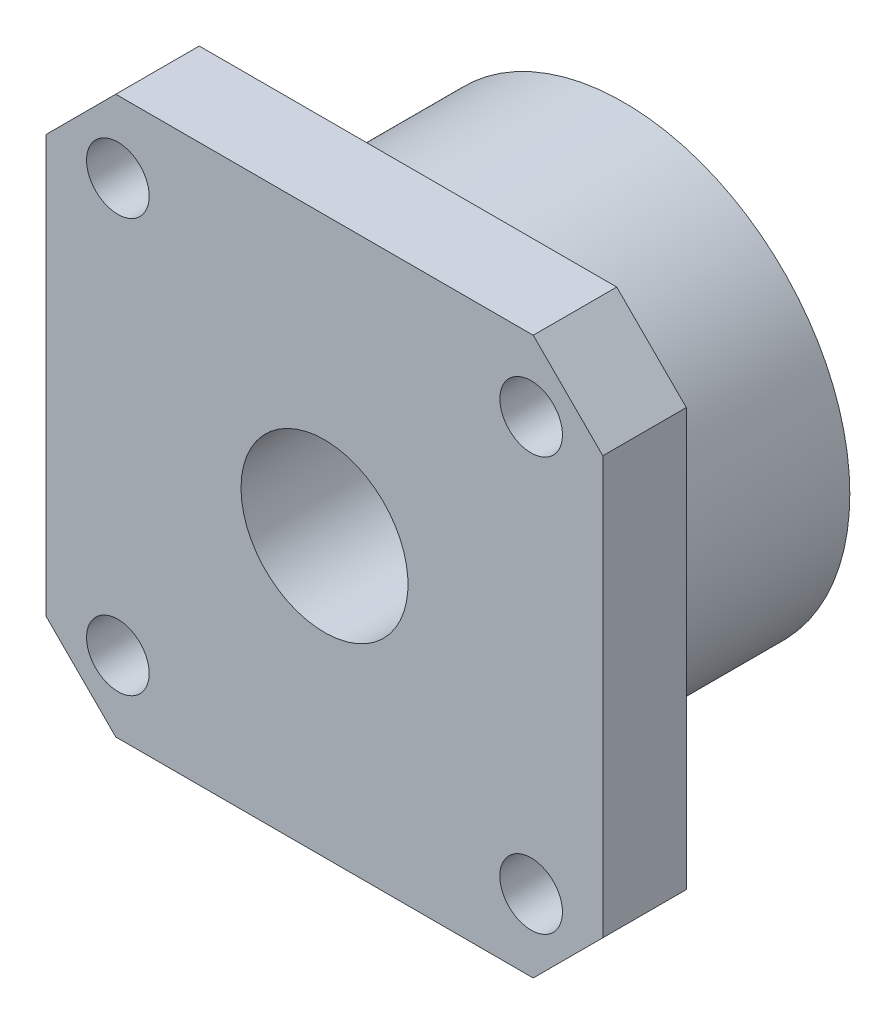
from build123d import *

# Parameters (mm, degrees)
SKETCH_1_W          = 40
SKETCH_1_H          = 40
SKETCH_1_R          = 2.25
EXTRUDE_1_DEPTH     = 6
CHAMFER_1_SIZE      = 5
SKETCH_2_R          = 16.25
SKETCH_2_R_2        = 6
EXTRUDE_2_DEPTH     = 15.5
SKETCH_3_R          = 6
CUT_EXTRUDE_1_DEPTH = 33.252906846


with BuildPart() as part:
    # 草图1 → 凸台-拉伸1 (new body)
    with BuildSketch(Plane.XY):
        Rectangle(SKETCH_1_W, SKETCH_1_H)
        with Locations((-14.849242405, 14.849242405)):
            Circle(SKETCH_1_R, mode=Mode.SUBTRACT)
        with Locations((14.849242405, 14.849242405)):
            Circle(SKETCH_1_R, mode=Mode.SUBTRACT)
        with Locations((14.849242405, -14.849242405)):
            Circle(SKETCH_1_R, mode=Mode.SUBTRACT)
        with Locations((-14.849242405, -14.849242405)):
            Circle(SKETCH_1_R, mode=Mode.SUBTRACT)
    extrude(amount=EXTRUDE_1_DEPTH)

    # 倒角1
    chamfer_1_edges = [part.edges().sort_by_distance(p)[0] for p in [
        (-20, 20, 3),
        (20, 20, 3),
        (20, -20, 3),
        (-20, -20, 3),
    ]]
    chamfer(chamfer_1_edges, length=CHAMFER_1_SIZE)

    # 草图2 → 凸台-拉伸2 (add)
    with BuildSketch(Plane(origin=(0, 0, 0), x_dir=(-1, 0, 0), z_dir=(0, 0, -1))):
        with Locations(Location((0, 0, 0), (0, 0, 180))):
            Circle(SKETCH_2_R)
        Circle(SKETCH_2_R_2, mode=Mode.SUBTRACT)
    extrude(amount=EXTRUDE_2_DEPTH)

    # 草图3 → 切除-拉伸1 (cut, through all)
    with BuildSketch(Plane(origin=(0, 0, 0), x_dir=(-1, 0, 0), z_dir=(0, 0, -1))):
        Circle(SKETCH_3_R)
    extrude(amount=-CUT_EXTRUDE_1_DEPTH, mode=Mode.SUBTRACT)


solid = part.part
